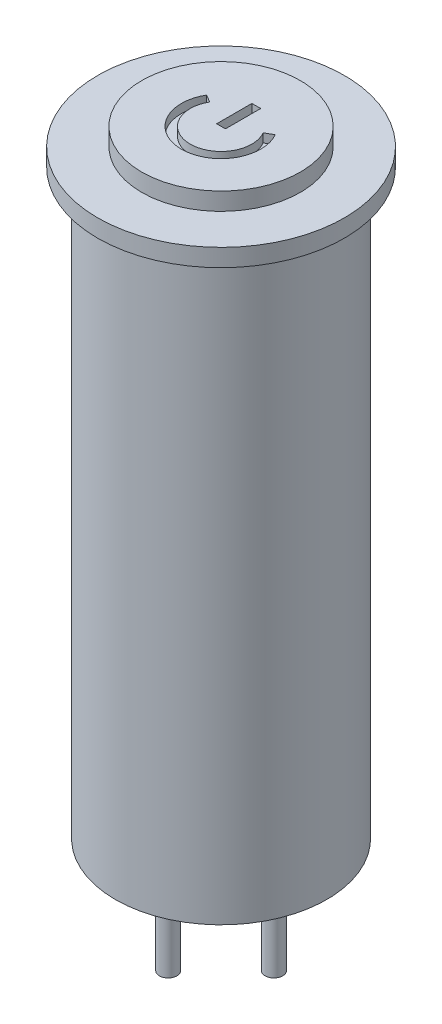
from build123d import *

# Parameters (mm, degrees)
SKETCH_1_R          = 7
EXTRUDE_1_DEPTH     = 1
SKETCH_2_R          = 4.5
EXTRUDE_2_DEPTH     = 1
SKETCH_3_W          = 0.5
SKETCH_3_H          = 2
CUT_EXTRUDE_1_DEPTH = 0.5
SKETCH_4_R          = 6
EXTRUDE_3_DEPTH     = 33
SKETCH_5_R          = 0.5
EXTRUDE_4_DEPTH     = 5


with BuildPart() as part:
    # 草图1 → 凸台-拉伸1 (new body)
    with BuildSketch(Plane(origin=(0, 0, 0), x_dir=(1, 0, 0), z_dir=(0, 1, 0))):
        with Locations(Location((0, 0, 0), (0, 0, 270))):
            Circle(SKETCH_1_R)
    extrude(amount=EXTRUDE_1_DEPTH)

    # 草图2 → 凸台-拉伸2 (add)
    with BuildSketch(Plane(origin=(0, 1, 0), x_dir=(1, 0, 0), z_dir=(0, 1, 0))):
        with Locations(Location((0, 0, 0), (0, 0, 270))):
            Circle(SKETCH_2_R)
    extrude(amount=EXTRUDE_2_DEPTH)

    # 草图3 → 切除-拉伸-薄壁1 (cut)
    with BuildSketch(Plane(origin=(0, 2, 0), x_dir=(1, 0, 0), z_dir=(0, 1, 0))):
        with Locations((0, 1)):
            Rectangle(SKETCH_3_W, SKETCH_3_H)
        with BuildLine():
            ThreePointArc((-1.948557159, 1.125), (0, -2.25), (1.948557159, 1.125))
            Line((1.948557159, 1.125), (1.515544457, 0.875))
            ThreePointArc((1.515544457, 0.875), (0, -1.75), (-1.515544457, 0.875))
            Line((-1.515544457, 0.875), (-1.948557159, 1.125))
        make_face()
    extrude(amount=-CUT_EXTRUDE_1_DEPTH, mode=Mode.SUBTRACT)

    # 草图4 → 凸台-拉伸3 (add)
    with BuildSketch(Plane.XZ):
        with Locations(Location((0, 0, 0), (0, 0, 270))):
            Circle(SKETCH_4_R)
    extrude(amount=EXTRUDE_3_DEPTH)

    # 草图5 → 凸台-拉伸4 (add)
    with BuildSketch(Plane.XZ.offset(33)):
        with Locations(Location((0, 3, 0), (0, 0, 270))):
            Circle(SKETCH_5_R)
        with Locations(Location((3, 0, 0), (0, 0, 270))):
            Circle(SKETCH_5_R)
        with Locations(Location((0, -3, 0), (0, 0, 270))):
            Circle(SKETCH_5_R)
        with Locations(Location((-3, 0, 0), (0, 0, 270))):
            Circle(SKETCH_5_R)
    extrude(amount=EXTRUDE_4_DEPTH)


solid = part.part
